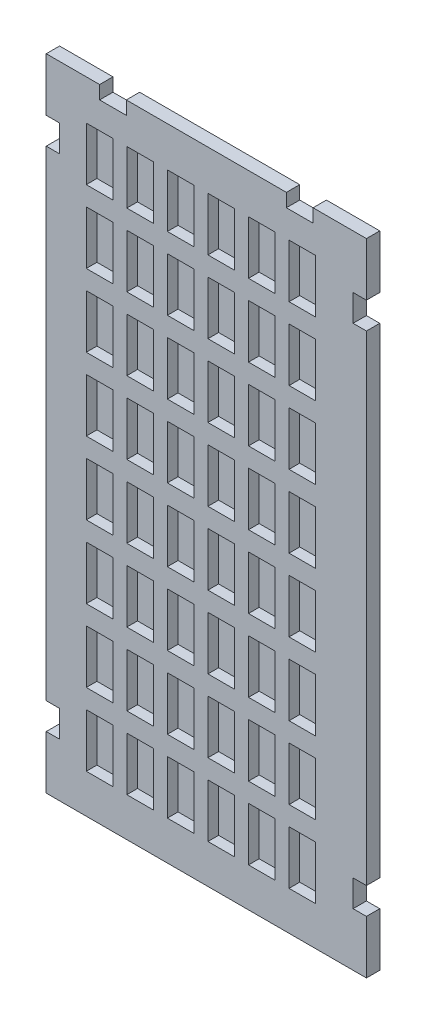
from build123d import *

# Parameters (mm, degrees)
BOSS_EXTRUDE1_DEPTH  = 3.175
SKETCH2_W            = 6.35
SKETCH2_H            = 12.7
CUT_EXTRUDE1_DEPTH   = 2.54
LPATTERN1_COUNT      = 6
LPATTERN1_PITCH      = 9.652
LPATTERN1_COUNT_DIR2 = 8
LPATTERN1_PITCH_DIR2 = 17.272


with BuildPart() as part:
    # Sketch1 → Boss-Extrude1 (new body)
    with BuildSketch(Plane.XY):
        Polygon((0, -152.4), (12.7, -152.4), (63.5, -152.4), (76.2, -152.4), (76.2, -139.7), (73.025, -139.7), (73.025, -133.35), (76.2, -133.35), (76.2, -19.05), (73.025, -19.05), (73.025, -12.7), (76.2, -12.7), (76.2, 0), (63.5, 0), (63.5, -3.175), (57.15, -3.175), (57.15, 0), (19.05, 0), (19.05, -3.175), (12.7, -3.175), (12.7, 0), (0, 0), (0, -12.7), (3.175, -12.7), (3.175, -19.05), (0, -19.05), (0, -133.35), (3.175, -133.35), (3.175, -139.7), (0, -139.7), align=None)
    extrude(amount=BOSS_EXTRUDE1_DEPTH)

    # Sketch2 → Cut-Extrude1 (cut)
    with BuildSketch(Plane.XY.offset(3.175)):
        with Locations((12.7, -15.875)):
            Rectangle(SKETCH2_W, SKETCH2_H)
    cut_extrude1 = extrude(amount=-CUT_EXTRUDE1_DEPTH, mode=Mode.SUBTRACT)

    # LPattern1: Cut-Extrude1 6 × 8
    with Locations(*[(i * LPATTERN1_PITCH, -j * LPATTERN1_PITCH_DIR2, 0) for i in range(LPATTERN1_COUNT) for j in range(LPATTERN1_COUNT_DIR2) if (i, j) != (0, 0)]):
        add(cut_extrude1, mode=Mode.SUBTRACT)


solid = part.part
